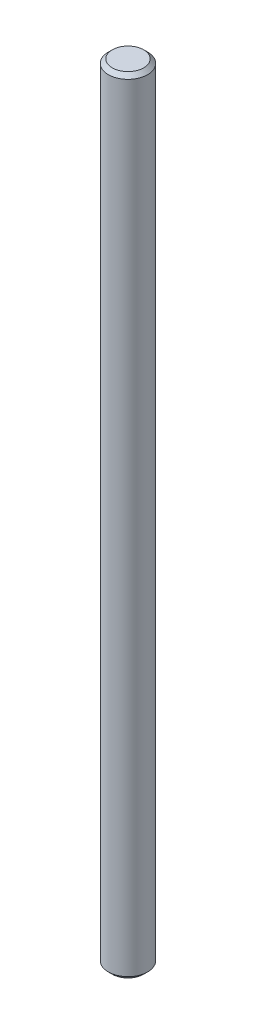
from build123d import *

# Parameters (mm, degrees)
SKETCH1_R           = 4
BOSS_EXTRUDE1_DEPTH = 160
CHAMFER1_SIZE       = 0.8


with BuildPart() as part:
    # Sketch1 → Boss-Extrude1 (new body)
    with BuildSketch(Plane(origin=(0, 0, 0), x_dir=(1, 0, 0), z_dir=(0, 1, 0))):
        with Locations(Location((0, 0, 0), (0, 0, 270))):
            Circle(SKETCH1_R)
    extrude(amount=BOSS_EXTRUDE1_DEPTH)

    # Chamfer1
    chamfer1_edges = [part.edges().sort_by_distance(p)[0] for p in [
        (0, 0, -4),
        (0, 160, -4),
    ]]
    chamfer(chamfer1_edges, length=CHAMFER1_SIZE)


solid = part.part
